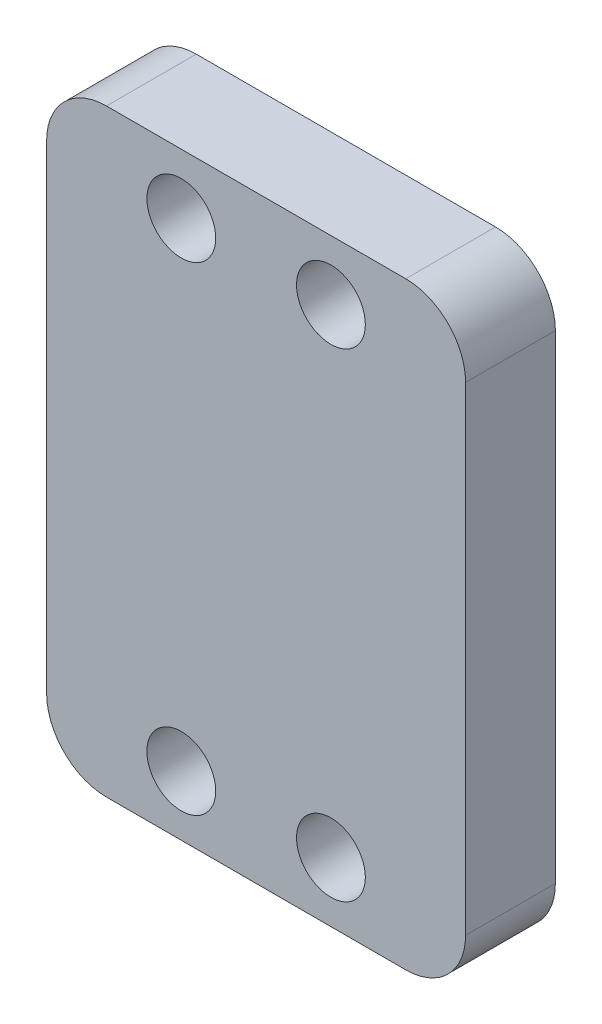
from build123d import *

# Parameters (mm, degrees)
SKETCH_1_W          = 14
SKETCH_1_H          = 20
EXTRUDE_1_DEPTH     = 1.5
SKETCH_2_R          = 1.15
CUT_EXTRUDE_1_DEPTH = 13.56980509
FILLET_1_R          = 2


with BuildPart() as part:
    # 草图1 → 凸台-拉伸1 (new, symmetric)
    with BuildSketch(Plane.XY):
        Rectangle(SKETCH_1_W, SKETCH_1_H)
    extrude(amount=EXTRUDE_1_DEPTH, both=True)

    # 草图2 → 切除-拉伸1 (cut, through all)
    with BuildSketch(Plane.XY.offset(1.5)):
        with Locations((-2.5, 8)):
            Circle(SKETCH_2_R)
        with Locations((2.5, 8)):
            Circle(SKETCH_2_R)
        with Locations((-2.5, -8)):
            Circle(SKETCH_2_R)
        with Locations((2.5, -8)):
            Circle(SKETCH_2_R)
    extrude(amount=-CUT_EXTRUDE_1_DEPTH, mode=Mode.SUBTRACT)

    # 圆角1
    fillet_1_edges = [part.edges().sort_by_distance(p)[0] for p in [
        (7, -10, 0),
        (-7, -10, 0),
        (-7, 10, 0),
        (7, 10, 0),
    ]]
    fillet(fillet_1_edges, radius=FILLET_1_R)


solid = part.part
